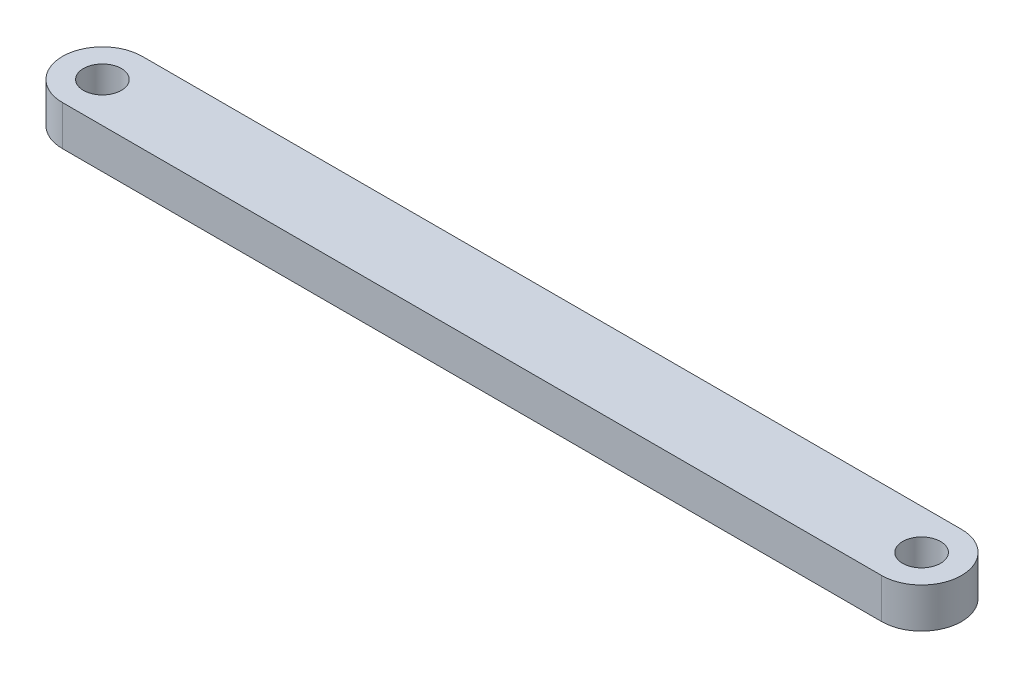
from build123d import *

# Parameters (mm, degrees)
SKETCH1_R           = 0.95
BOSS_EXTRUDE1_DEPTH = 1


with BuildPart() as part:
    # Sketch1 → Boss-Extrude1 (new, symmetric)
    with BuildSketch(Plane(origin=(0, 0, 0), x_dir=(1, 0, 0), z_dir=(0, 1, 0))):
        with BuildLine():
            Line((-20.5, 2), (20.5, 2))
            ThreePointArc((20.5, 2), (22.5, 0), (20.5, -2))
            Line((20.5, -2), (-20.5, -2))
            ThreePointArc((-20.5, -2), (-22.5, 0), (-20.5, 2))
        make_face()
        with Locations(Location((-20.5, 0, 0), (0, 0, 270))):
            Circle(SKETCH1_R, mode=Mode.SUBTRACT)
        with Locations(Location((20.5, 0, 0), (0, 0, 270))):
            Circle(SKETCH1_R, mode=Mode.SUBTRACT)
    extrude(amount=BOSS_EXTRUDE1_DEPTH, both=True)


solid = part.part
